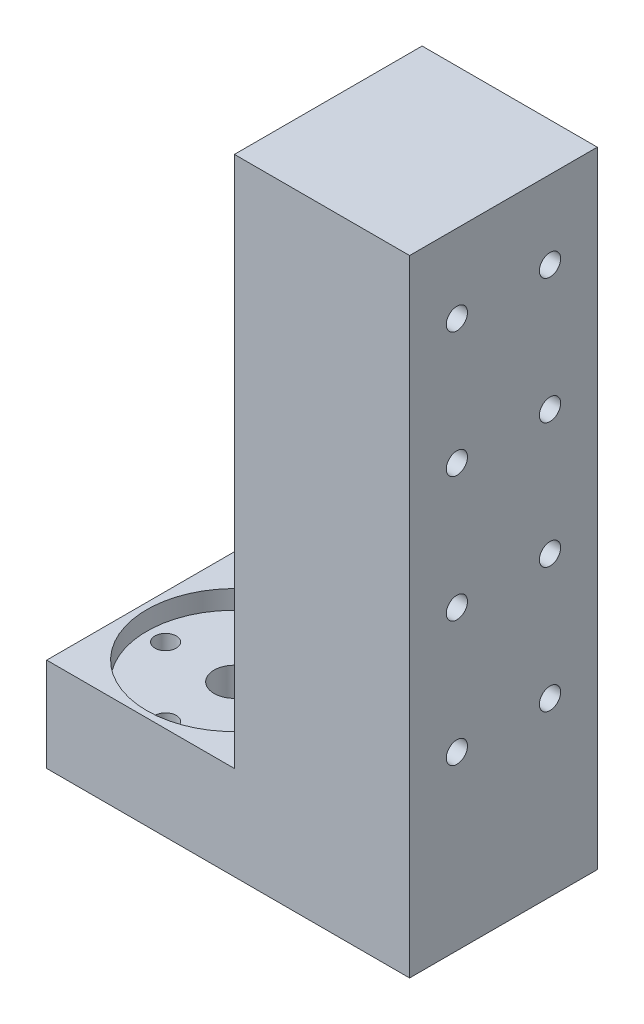
from build123d import *

# Parameters (mm, degrees)
BOSS_EXTRUDE1_DEPTH = 30
SKETCH3_R           = 14
CUT_EXTRUDE1_DEPTH  = 3
SKETCH4_R           = 1.7
SKETCH4_R_2         = 3.25
CUT_EXTRUDE2_DEPTH  = 110.581020254
SKETCH5_R           = 1.7
CUT_EXTRUDE3_DEPTH  = 109.627804912


with BuildPart() as part:
    # Sketch2 → Boss-Extrude1 (new body)
    with BuildSketch(Plane.XY):
        Polygon((0, 0), (0, 15), (30, 15), (30, 100), (58, 100), (58, 0), (30, 0), align=None)
    extrude(amount=BOSS_EXTRUDE1_DEPTH)

    # Sketch3 → Cut-Extrude1 (cut)
    with BuildSketch(Plane(origin=(0, 15, 0), x_dir=(1, 0, 0), z_dir=(0, 1, 0))):
        with Locations(Location((15, -15, 0), (0, 0, 270))):
            Circle(SKETCH3_R)
    extrude(amount=-CUT_EXTRUDE1_DEPTH, mode=Mode.SUBTRACT)

    # Sketch4 → Cut-Extrude2 (cut, through all)
    with BuildSketch(Plane(origin=(0, 12, 0), x_dir=(1, 0, 0), z_dir=(0, 1, 0))):
        with Locations(Location((15, -4, 0), (0, 0, 270))):
            Circle(SKETCH4_R)
        with Locations(Location((26, -15, 0), (0, 0, 270))):
            Circle(SKETCH4_R)
        with Locations(Location((15, -26, 0), (0, 0, 270))):
            Circle(SKETCH4_R)
        with Locations(Location((4, -15, 0), (0, 0, 270))):
            Circle(SKETCH4_R)
        with Locations(Location((15, -15, 0), (0, 0, 270))):
            Circle(SKETCH4_R_2)
    extrude(amount=-CUT_EXTRUDE2_DEPTH, mode=Mode.SUBTRACT)

    # Sketch5 → Cut-Extrude3 (cut, through all)
    with BuildSketch(Plane.ZY.offset(-30)):
        with Locations(Location((7.558876463, 27.5, 0), (0, 0, 270))):
            Circle(SKETCH5_R)
        with Locations(Location((7.558876463, 47.5, 0), (0, 0, 270))):
            Circle(SKETCH5_R)
        with Locations(Location((7.558876463, 67.5, 0), (0, 0, 270))):
            Circle(SKETCH5_R)
        with Locations(Location((7.558876463, 87.5, 0), (0, 0, 270))):
            Circle(SKETCH5_R)
        with Locations(Location((22.441123537, 27.5, 0), (0, 0, 90))):
            Circle(SKETCH5_R)
        with Locations(Location((22.441123537, 47.5, 0), (0, 0, 90))):
            Circle(SKETCH5_R)
        with Locations(Location((22.441123537, 67.5, 0), (0, 0, 90))):
            Circle(SKETCH5_R)
        with Locations(Location((22.441123537, 87.5, 0), (0, 0, 90))):
            Circle(SKETCH5_R)
    extrude(amount=-CUT_EXTRUDE3_DEPTH, mode=Mode.SUBTRACT)


solid = part.part
